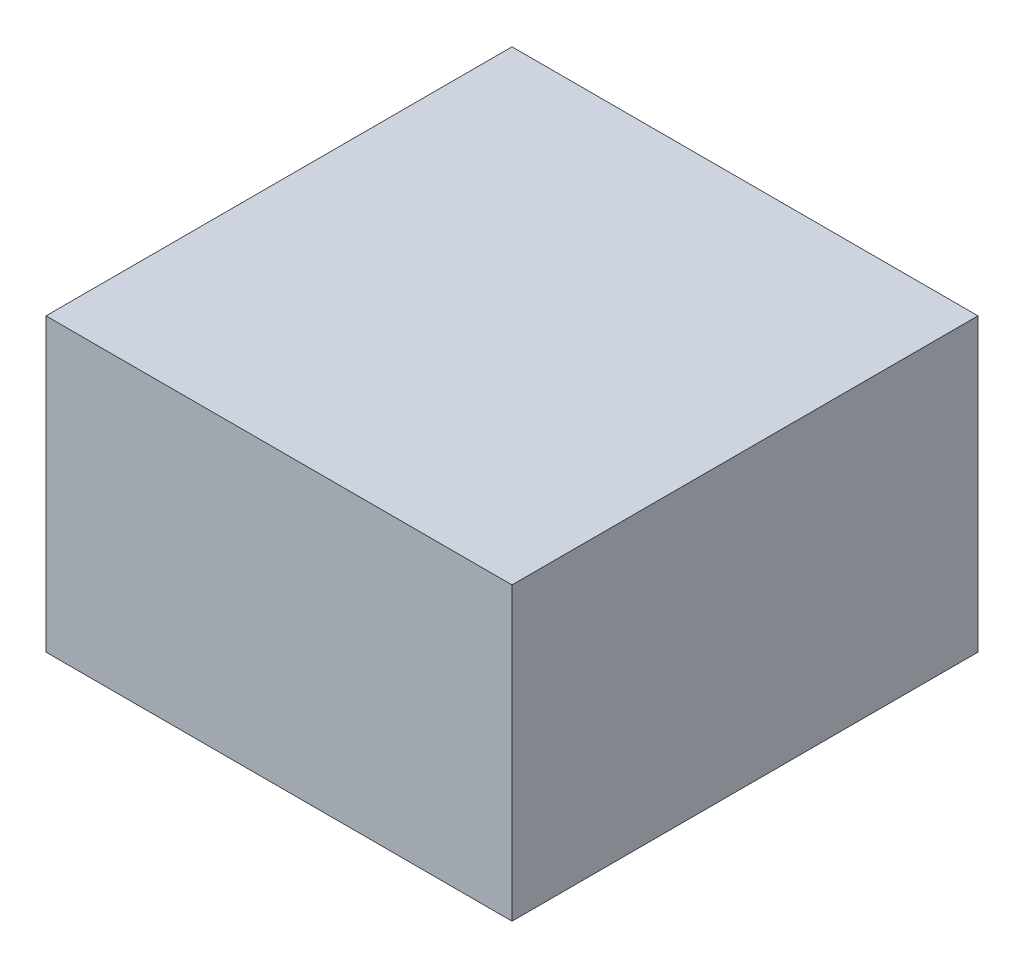
from build123d import *

# Parameters (mm, degrees)
SKETCH1_W           = 80
SKETCH1_H           = 80
BOSS_EXTRUDE1_DEPTH = 50


with BuildPart() as part:
    # Sketch1 → Boss-Extrude1 (new body)
    with BuildSketch(Plane(origin=(0, 0, 0), x_dir=(1, 0, 0), z_dir=(0, 1, 0))):
        Rectangle(SKETCH1_W, SKETCH1_H)
    extrude(amount=BOSS_EXTRUDE1_DEPTH)


solid = part.part
